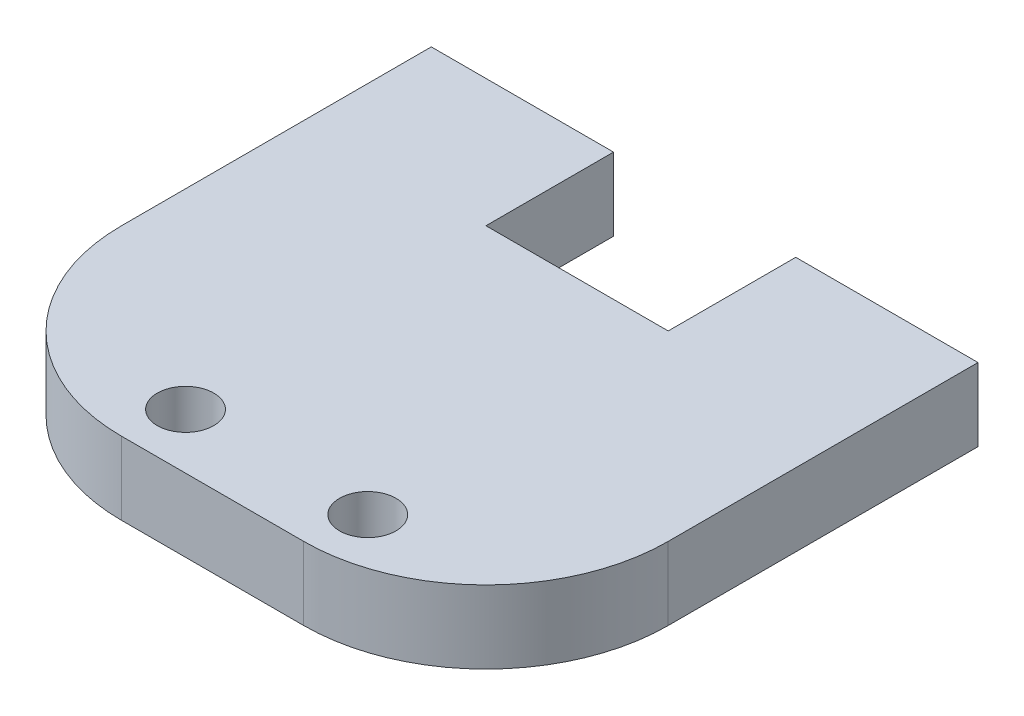
from build123d import *

# Parameters (mm, degrees)
BOSS_EXTRU_1_DEPTH      = 4
CONG_1_R                = 10
ESQUISSE3_R             = 1.55
ENL_V_MAT_EXTRU_1_DEPTH = 10


with BuildPart() as part:
    # Esquisse2 → Boss.-Extru.1 (new body)
    with BuildSketch(Plane(origin=(0, 0, 0), x_dir=(1, 0, 0), z_dir=(0, 1, 0))):
        Polygon((-15, 4.125844984), (-15, 7), (-5, 7), (-5, 0), (5, 0), (5, 7), (15, 7), (15, 0.999487428), (15, -20), (-15, -20), align=None)
    extrude(amount=BOSS_EXTRU_1_DEPTH)

    # Congé1
    cong_1_edges = [part.edges().sort_by_distance(p)[0] for p in [
        (15, 2, 20),
        (-15, 2, 20),
    ]]
    fillet(cong_1_edges, radius=CONG_1_R)

    # Esquisse3 → Enlèv. mat.-Extru.1 (cut)
    with BuildSketch(Plane(origin=(0, 4, 0), x_dir=(1, 0, 0), z_dir=(0, 1, 0))):
        with Locations(Location((5.483505043, -16.969125841, 0), (0, 0, 270))):
            Circle(ESQUISSE3_R)
        with Locations(Location((-4.516494957, -16.969125841, 0), (0, 0, 270))):
            Circle(ESQUISSE3_R)
    extrude(amount=-ENL_V_MAT_EXTRU_1_DEPTH, mode=Mode.SUBTRACT)


solid = part.part
